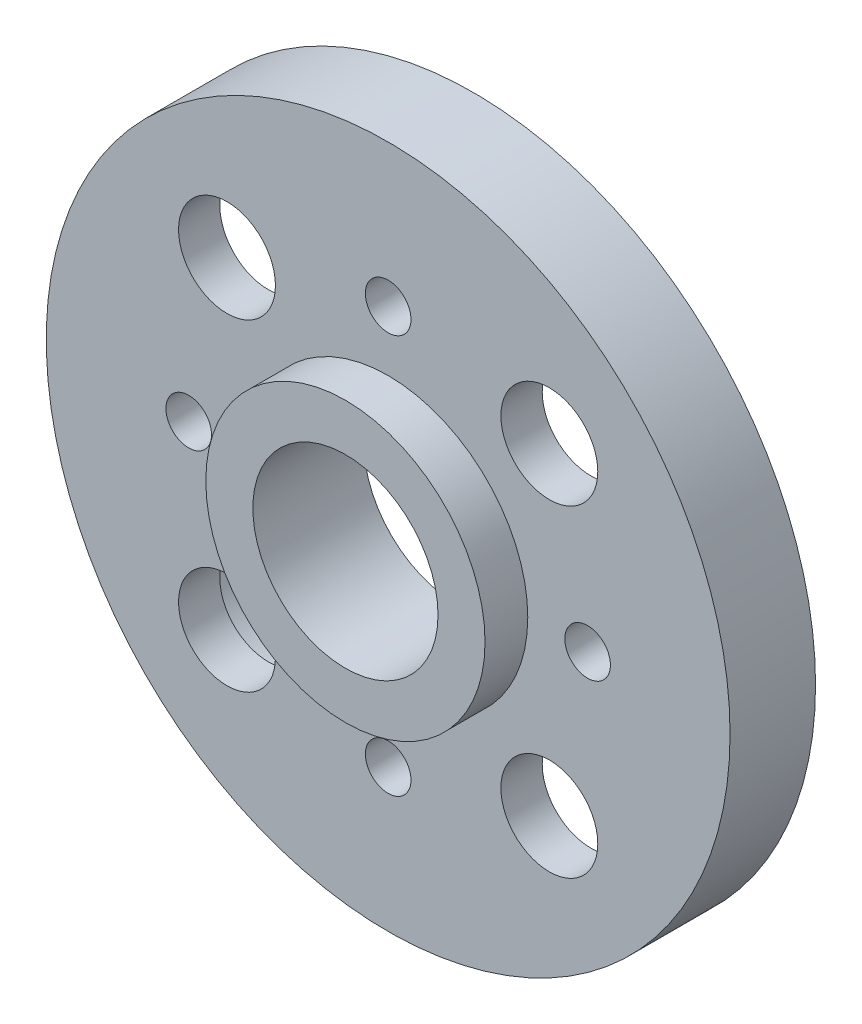
from build123d import *

# Parameters (mm, degrees)
D24_D6_5_R                      = 12
D24_D6_5_R_2                    = 3.25
D24_3_D6_5_DEPTH                = 3
EXTRUDE_START                   = 3
SKETCH_D9_8_1_5_R               = 4.9
SKETCH_D9_8_1_5_R_2             = 3.25
EXTRUDE_D9_8_1_5_DEPTH          = 1.5
F_4XD3_4_D6_3_PCD16_D           = 3.4
F_4XD3_4_D6_3_PCD16_CBORE_D     = 6.3
F_4XD3_4_D6_3_PCD16_CBORE_DEPTH = 1.55
SKETCH_1093_R                   = 10.05
CUT_EXTRUDE_D20_1_0_6_DEPTH     = 0.6
F_4XM2X0_4_PCD14_D              = 1.6


with BuildPart() as part:
    # 转接板_D24_工具通孔D6.5_截面 → 转接板_D24_厚3_工具通孔D6.5 (new body)
    with BuildSketch(Plane.XY):
        Circle(D24_D6_5_R)
        Circle(D24_D6_5_R_2, mode=Mode.SUBTRACT)
    extrude(amount=D24_3_D6_5_DEPTH)

    # 轴承内孔定位台_D9.8_高1.5_截面 → 轴承内孔定位台_D9.8_高1.5 (add)
    with BuildSketch(Plane.XY.offset(EXTRUDE_START)):
        Circle(SKETCH_D9_8_1_5_R)
        Circle(SKETCH_D9_8_1_5_R_2, mode=Mode.SUBTRACT)
    extrude(amount=EXTRUDE_D9_8_1_5_DEPTH)

    # 轴承内圈_4xD3.4通孔_D6.3平底沉孔_PCD16 (through all)
    with Locations(Plane(origin=(5.656854249, -5.656854249, 0), x_dir=(-1, 0, 0), z_dir=(0, 0, -1))):
        with Locations((0, 0), (11.313708498, 0), (11.313708498, 11.313708498), (0, 11.313708498)):
            CounterBoreHole(F_4XD3_4_D6_3_PCD16_D / 2, F_4XD3_4_D6_3_PCD16_CBORE_D / 2, F_4XD3_4_D6_3_PCD16_CBORE_DEPTH)

    # Sketch 1093 → 原舵盘定位槽_D20.1_深0.6 (cut)
    with BuildSketch(Plane.XY):
        Circle(SKETCH_1093_R)
    extrude(amount=CUT_EXTRUDE_D20_1_0_6_DEPTH, mode=Mode.SUBTRACT)

    # 原舵盘_4xM2x0.4通螺纹_PCD14 (through all)
    with Locations(Plane(origin=(0, -7, 0.6), x_dir=(-1, 0, 0), z_dir=(0, 0, -1))):
        with Locations((0, 0), (7, 7), (0, 14), (-7, 7)):
            Hole(F_4XM2X0_4_PCD14_D / 2)


solid = part.part
